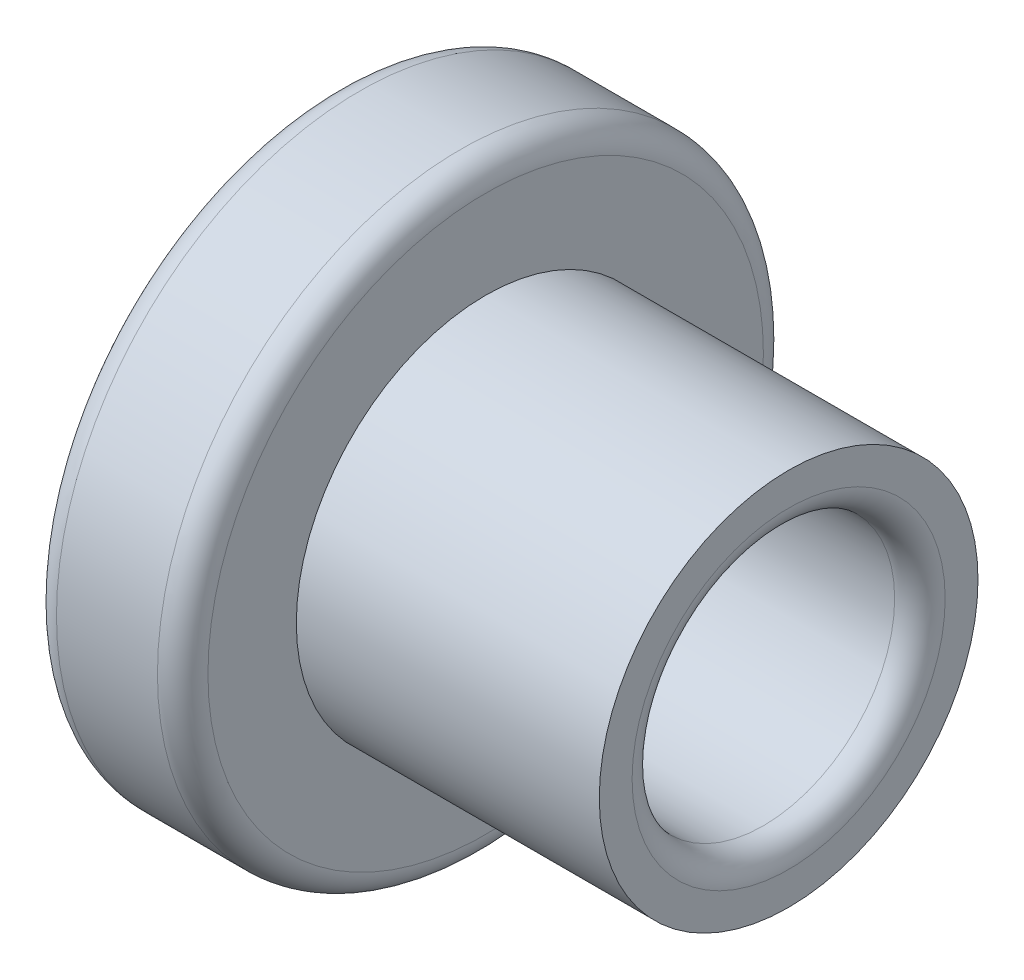
from build123d import *

# Parameters (mm, degrees)
SKETCH1_R           = 7.62
SKETCH1_R_2         = 3.302
BOSS_EXTRUDE1_DEPTH = 3.81
SKETCH2_R           = 4.7625
SKETCH2_R_2         = 3.302
BOSS_EXTRUDE2_DEPTH = 10.795
FILLET1_R           = 0.635
CHAMFER1_SIZE       = 3.175
CHAMFER1_SIZE2      = 3.652419693
CUT_EXTRUDE1_START  = -3.175
SKETCH3_R           = 4.7625
CUT_EXTRUDE1_DEPTH  = 3.175
FILLET2_R           = 0.635


with BuildPart() as part:
    # Sketch1 → Boss-Extrude1 (new body)
    with BuildSketch(Plane(origin=(0, 0, 0), x_dir=(0, 0, -1), z_dir=(1, 0, 0))):
        with Locations(Location((0, 0, 0), (0, 0, 180))):
            Circle(SKETCH1_R)
        with Locations(Location((0, 0, 0), (0, 0, 180))):
            Circle(SKETCH1_R_2, mode=Mode.SUBTRACT)
    extrude(amount=BOSS_EXTRUDE1_DEPTH)

    # Sketch2 → Boss-Extrude2 (add)
    with BuildSketch(Plane(origin=(3.81, 0, 0), x_dir=(0, 0, -1), z_dir=(1, 0, 0))):
        Circle(SKETCH2_R)
        with Locations(Location((0, 0, 0), (0, 0, 180))):
            Circle(SKETCH2_R_2, mode=Mode.SUBTRACT)
    extrude(amount=BOSS_EXTRUDE2_DEPTH)

    # Fillet1
    fillet1_edges = [part.edges().sort_by_distance(p)[0] for p in [
        (14.605, 0, -3.302),
        (0, 0, -7.62),
        (3.81, 0, -7.62),
    ]]
    fillet(fillet1_edges, radius=FILLET1_R)

    # Chamfer1
    chamfer1_edges = [part.edges().sort_by_distance(p)[0] for p in [
        (0, 0, -3.302),
    ]]
    chamfer1_side = [part.faces().sort_by_distance(p)[0] for p in [
        (6.985, 0, -3.302),
    ]]
    chamfer(chamfer1_edges, length=CHAMFER1_SIZE, length2=CHAMFER1_SIZE2, reference=chamfer1_side[0])

    # Sketch3 → Cut-Extrude1 (cut)
    with BuildSketch(Plane(origin=(14.605, 0, 0), x_dir=(0, 0, -1), z_dir=(1, 0, 0)).offset(CUT_EXTRUDE1_START)):
        Circle(SKETCH3_R)
    extrude(amount=CUT_EXTRUDE1_DEPTH, mode=Mode.SUBTRACT)

    # Fillet2
    fillet2_edges = [part.edges().sort_by_distance(p)[0] for p in [
        (11.43, 0, -3.302),
    ]]
    fillet(fillet2_edges, radius=FILLET2_R)


solid = part.part
